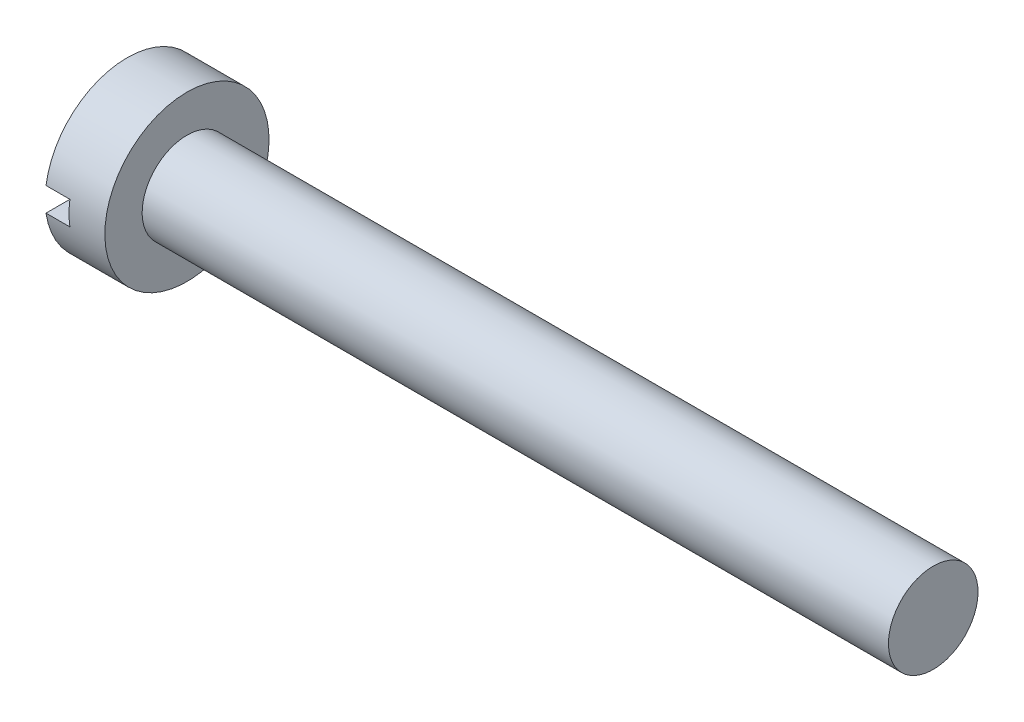
from build123d import *

# Parameters (mm, degrees)
SKETCH2_W          = 5.5
SKETCH2_H          = 0.8
CUT_EXTRUDE1_DEPTH = 0.8


with BuildPart() as part:
    # Sketch1 → Revolve1 (revolve)
    with BuildSketch(Plane.XY):
        Polygon((0, 0), (0, 2.75), (2, 2.75), (2, 1.5), (27, 1.5), (27, 0), align=None)
    revolve(axis=Axis((27, 0, 0), (-1, 0, 0)))

    # Sketch2 → Cut-Extrude1 (cut)
    with BuildSketch(Plane.ZY):
        Rectangle(SKETCH2_W, SKETCH2_H)
    extrude(amount=-CUT_EXTRUDE1_DEPTH, mode=Mode.SUBTRACT)


solid = part.part
